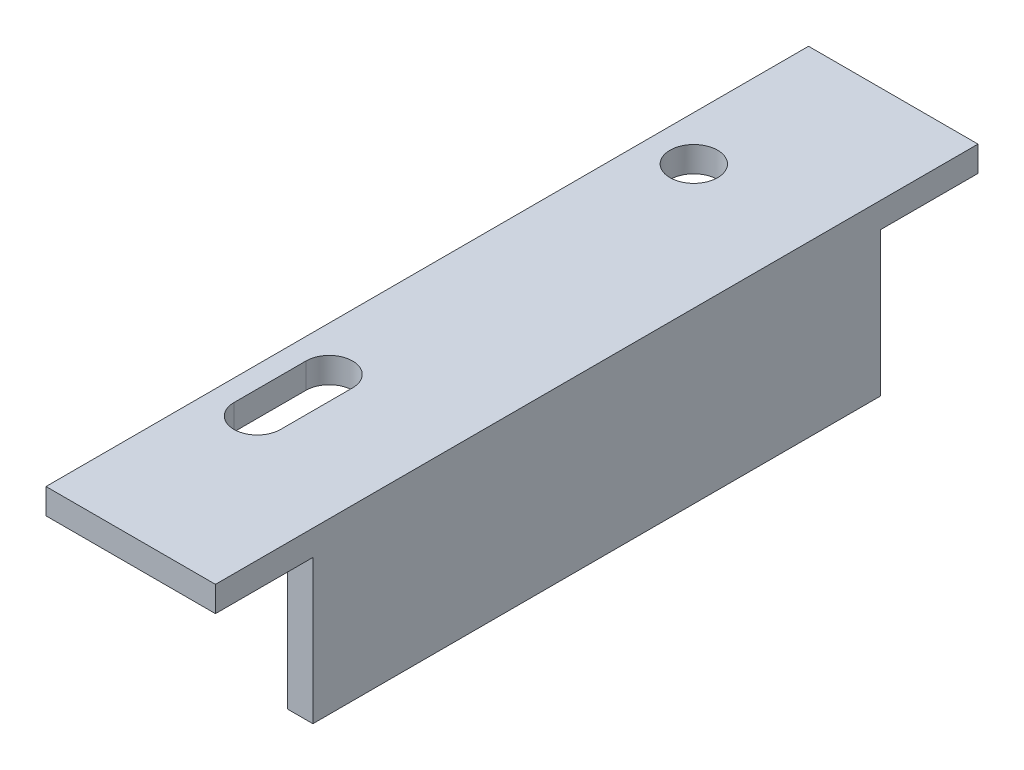
from build123d import *

# Parameters (mm, degrees)
BOSS_EXTRUDE1_DEPTH = 180
SKETCH2_W           = 23
SKETCH2_H           = 34
CUT_EXTRUDE1_DEPTH  = 200
SKETCH3_R           = 5.625
CUT_EXTRUDE2_DEPTH  = 200


with BuildPart() as part:
    # Sketch1 → Boss-Extrude1 (new body)
    with BuildSketch(Plane.XY):
        Polygon((0, 0), (40, 0), (40, -40), (34, -40), (34, -6), (0, -6), align=None)
    extrude(amount=-BOSS_EXTRUDE1_DEPTH)

    # Sketch2 → Cut-Extrude1 (cut)
    with BuildSketch(Plane.ZY.offset(-34)):
        with Locations((-11.5, -23)):
            Rectangle(SKETCH2_W, SKETCH2_H)
        with Locations((-168.5, -23)):
            Rectangle(SKETCH2_W, SKETCH2_H)
    extrude(amount=-CUT_EXTRUDE1_DEPTH, mode=Mode.SUBTRACT)

    # Sketch3 → Cut-Extrude2 (cut)
    with BuildSketch(Plane(origin=(0, 0, 0), x_dir=(1, 0, 0), z_dir=(0, 1, 0))):
        with Locations(Location((10.52, 142.4, 0), (0, 0, 270))):
            Circle(SKETCH3_R)
        with BuildLine():
            Line((16.02, 56.35), (16.02, 39.35))
            ThreePointArc((16.02, 39.35), (10.52, 33.85), (5.02, 39.35))
            Line((5.02, 39.35), (5.02, 56.35))
            ThreePointArc((5.02, 56.35), (10.52, 61.85), (16.02, 56.35))
        make_face()
    extrude(amount=-CUT_EXTRUDE2_DEPTH, mode=Mode.SUBTRACT)


solid = part.part
